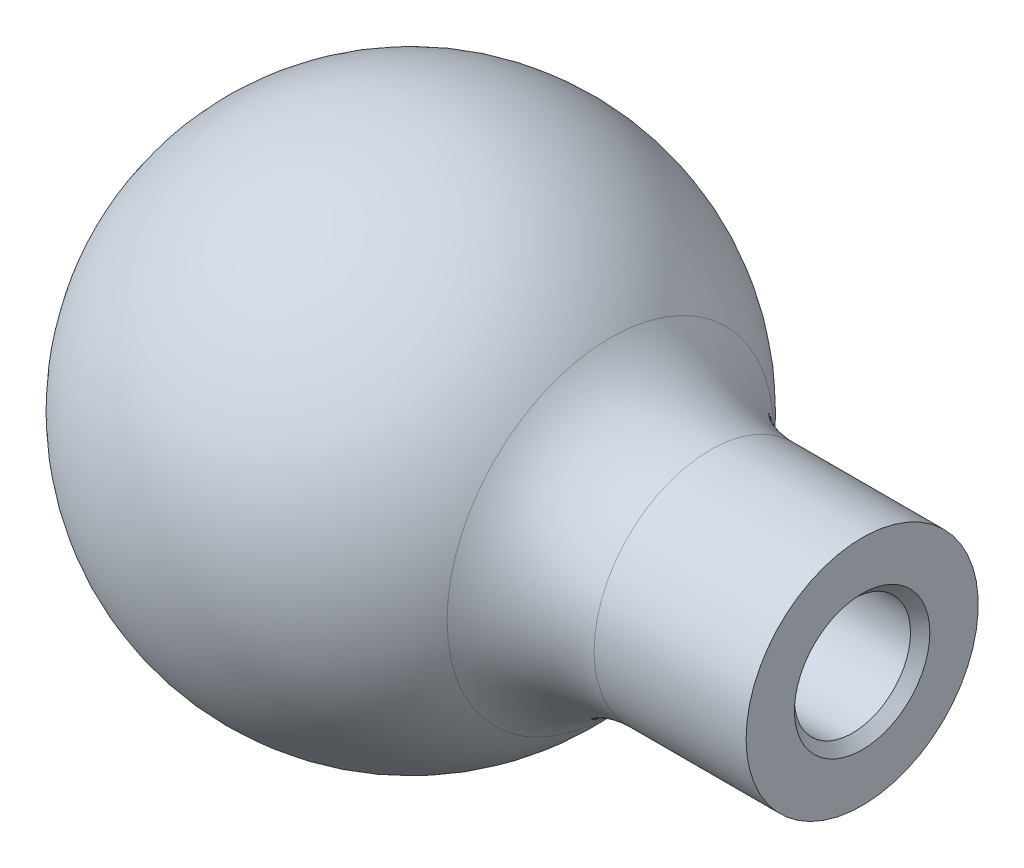
from build123d import *

# Parameters (mm, degrees)
FILLET1_R                        = 10
M10X1_0_TAPPED_HOLE1_D           = 9
M10X1_0_TAPPED_HOLE1_DEPTH       = 25
M10X1_0_TAPPED_HOLE1_CSINK_D     = 10.5
M10X1_0_TAPPED_HOLE1_CSINK_ANGLE = 90
M10X1_0_TAPPED_HOLE1_TIP         = 2.703872786


with BuildPart() as part:
    # Sketch1 → Revolve1 (revolve)
    with BuildSketch(Plane.XY):
        with BuildLine():
            Line((-20, 0), (35, 0))
            Line((35, 0), (35, 9))
            Line((35, 9), (17.860571099, 9))
            ThreePointArc((17.860571099, 9), (-4.625396092, 19.457793066), (-20, 0))
        make_face()
    revolve(axis=Axis((0, 0, 0), (1, 0, 0)))

    # Fillet1
    fillet1_edges = [part.edges().sort_by_distance(p)[0] for p in [
        (17.860571099, -9, 0),
    ]]
    fillet(fillet1_edges, radius=FILLET1_R)

    # M10x1.0 Tapped Hole1
    with Locations(Plane(origin=(35, 0, 0), x_dir=(0, 0, -1), z_dir=(1, 0, 0))):
        with Locations((0, 0)):
            CounterSinkHole(M10X1_0_TAPPED_HOLE1_D / 2, M10X1_0_TAPPED_HOLE1_CSINK_D / 2, depth=M10X1_0_TAPPED_HOLE1_DEPTH, counter_sink_angle=M10X1_0_TAPPED_HOLE1_CSINK_ANGLE)
            with Locations((0, 0, -(M10X1_0_TAPPED_HOLE1_DEPTH + M10X1_0_TAPPED_HOLE1_TIP / 2))):  # 118° drill point
                Cone(0, M10X1_0_TAPPED_HOLE1_D / 2, M10X1_0_TAPPED_HOLE1_TIP, mode=Mode.SUBTRACT)


solid = part.part
